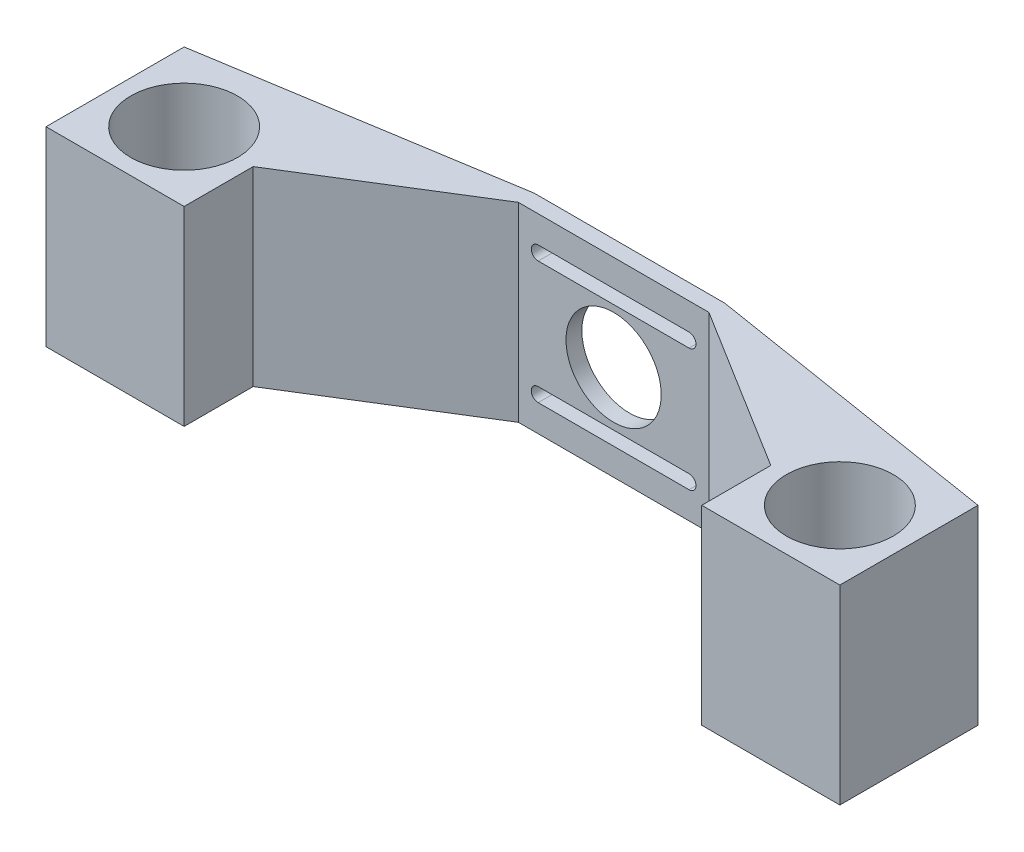
from build123d import *

# Parameters (mm, degrees)
SKETCH2_R           = 13.45
BOSS_EXTRUDE1_DEPTH = 48
SKETCH4_R           = 12
CUT_EXTRUDE1_DEPTH  = 48


with BuildPart() as part:
    # Sketch2 → Boss-Extrude1 (new body)
    with BuildSketch(Plane(origin=(0, 0, 0), x_dir=(1, 0, 0), z_dir=(0, 1, 0))):
        Polygon((-17.4, -17.4), (17.4, -17.4), (17.4, 0), (58.6, 25.6), (82.6, 25.6), (82.6, 29.6), (58.6, 29.6), (-17.4, 17.4), align=None)
        with Locations(Location((0, 0, 0), (0, 0, 270))):
            Circle(SKETCH2_R, mode=Mode.SUBTRACT)
    boss_extrude1 = extrude(amount=BOSS_EXTRUDE1_DEPTH)

    # Mirror1: Boss-Extrude1 across plane
    add(boss_extrude1.mirror(Plane(origin=(82.6, 0, 0), x_dir=(0, 0, 1), z_dir=(1, 0, 0))))

    # Sketch4 → Cut-Extrude1 (cut)
    with BuildSketch(Plane(origin=(0, 0, -29.6), x_dir=(-1, 0, 0), z_dir=(0, 0, -1))):
        with Locations((-82.6, 24)):
            Circle(SKETCH4_R)
        with BuildLine():
            Line((-101.6, 10.3), (-63.6, 10.3))
            ThreePointArc((-63.6, 10.3), (-61.85, 8.55), (-63.6, 6.8))
            Line((-63.6, 6.8), (-101.6, 6.8))
            ThreePointArc((-101.6, 6.8), (-103.35, 8.55), (-101.6, 10.3))
        make_face()
        with BuildLine():
            Line((-101.6, 37.7), (-63.6, 37.7))
            ThreePointArc((-63.6, 37.7), (-61.85, 39.45), (-63.6, 41.2))
            Line((-63.6, 41.2), (-101.6, 41.2))
            ThreePointArc((-101.6, 41.2), (-103.35, 39.45), (-101.6, 37.7))
        make_face()
    extrude(amount=-CUT_EXTRUDE1_DEPTH, mode=Mode.SUBTRACT)


solid = part.part
